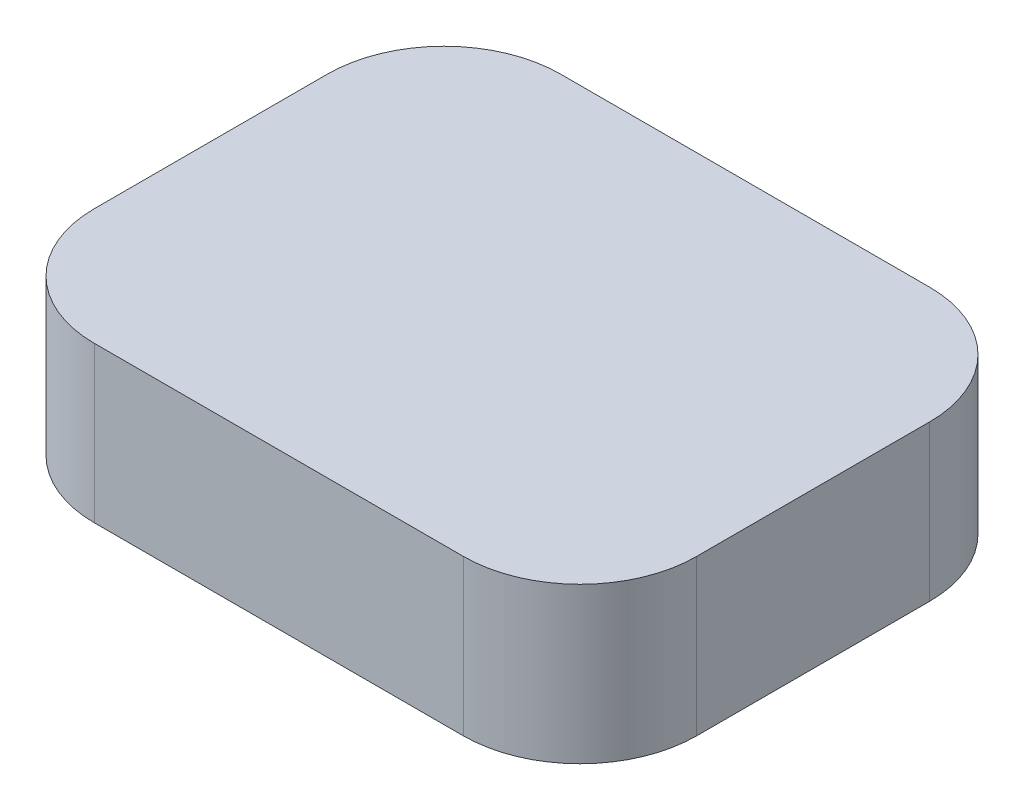
from build123d import *

# Parameters (mm, degrees)
SKETCH1_W           = 31
SKETCH1_H           = 24
BOSS_EXTRUDE1_DEPTH = 8
FILLET1_R           = 6


with BuildPart() as part:
    # Sketch1 → Boss-Extrude1 (new body)
    with BuildSketch(Plane(origin=(0, 0, 0), x_dir=(1, 0, 0), z_dir=(0, 1, 0))):
        Rectangle(SKETCH1_W, SKETCH1_H)
    extrude(amount=BOSS_EXTRUDE1_DEPTH)

    # Fillet1
    fillet1_edges = [part.edges().sort_by_distance(p)[0] for p in [
        (15.5, 4, 12),
        (-15.5, 4, 12),
        (-15.5, 4, -12),
        (15.5, 4, -12),
    ]]
    fillet(fillet1_edges, radius=FILLET1_R)


solid = part.part
